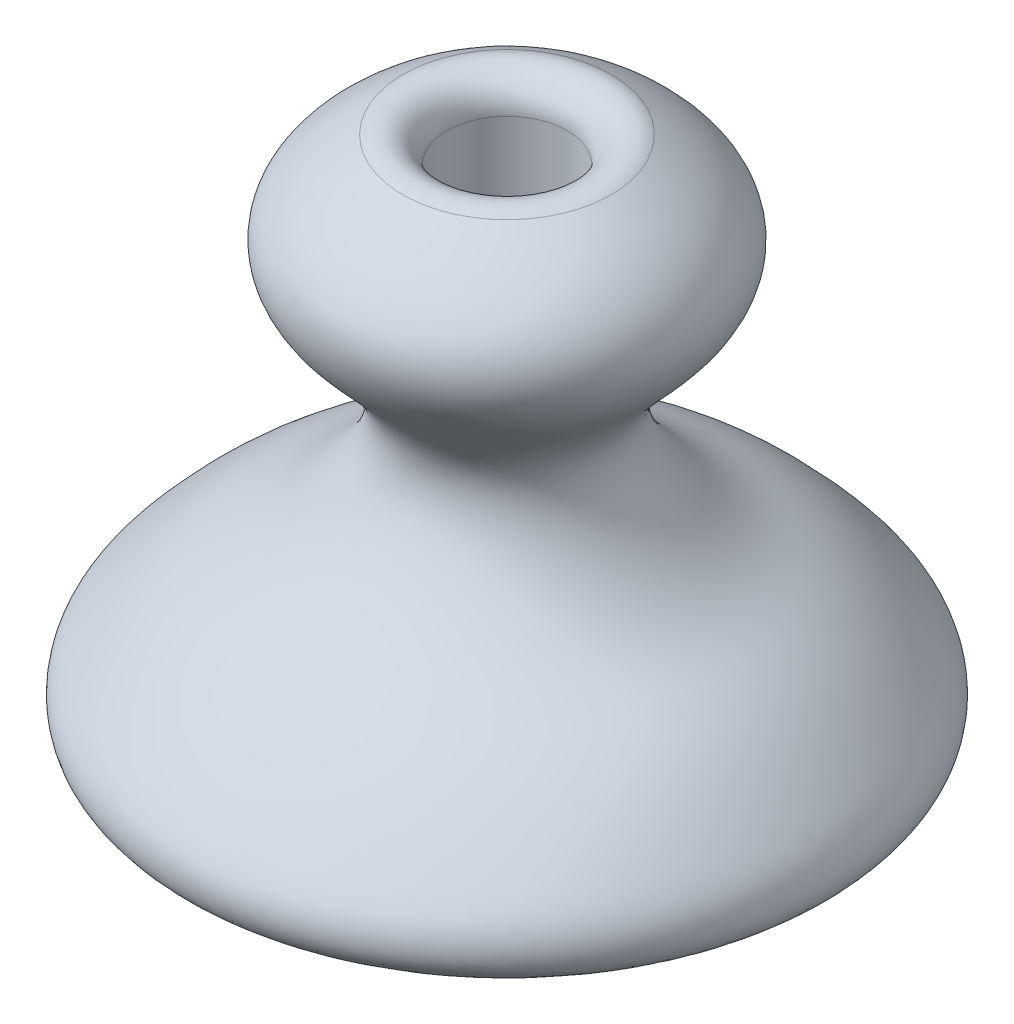
from build123d import *

# Parameters (mm, degrees)
SKETCH_3_R          = 4
CUT_EXTRUDE_1_DEPTH = 45.263110341
SKETCH_4_R          = 1.65
CUT_EXTRUDE_2_DEPTH = 44.256539845
FILLET_1_R          = 2


with BuildPart() as part:
    # 草图2 → 旋转1 (revolve)
    with BuildSketch(Plane(origin=(0, 0, 0), x_dir=(0, 0, -1), z_dir=(1, 0, 0))):
        with BuildLine():
            Line((0, 0), (0, 36.9438678))
            add(Edge.make_bspline(
                [(20.080767887, 0), (21.61992217, 0.396173772), (22.048203388, 2.702962278), (16.318399942, 9.554519138), (12.012534144, 9.668097732), (4.136478654, 18.908564942), (15.786716848, 28.108159005), (10.505835273, 33.681074023), (0, 36.9438678)],
                knots=[0, 0, 0, 0, 0.042121549, 0.074302995, 0.321814466, 0.52443649, 0.650070141, 1, 1, 1, 1], degree=3))
            Line((20.080767887, 0), (0, 0))
        make_face()
    revolve(axis=Axis((0, 0, 0), (0, 1, 0)))

    # 草图3 → 切除-拉伸1 (cut, through all)
    with BuildSketch(Plane(origin=(0, 5, 0), x_dir=(-1, 0, 0), z_dir=(0, -1, 0))):
        with Locations(Location((0, 0, 0), (0, 0, 90))):
            Circle(SKETCH_3_R)
    extrude(amount=-CUT_EXTRUDE_1_DEPTH, mode=Mode.SUBTRACT)

    # 草图4 → 切除-拉伸2 (cut, through all)
    with BuildSketch(Plane(origin=(0, 5, 0), x_dir=(1, 0, 0), z_dir=(0, 1, 0))):
        with Locations(Location((0, 0, 0), (0, 0, 270))):
            Circle(SKETCH_4_R)
    extrude(amount=-CUT_EXTRUDE_2_DEPTH, mode=Mode.SUBTRACT)

    # 圆角1
    fillet_1_edges = [part.edges().sort_by_distance(p)[0] for p in [
        (1e-09, 35.533849947, 4),
    ]]
    fillet(fillet_1_edges, radius=FILLET_1_R)


solid = part.part
